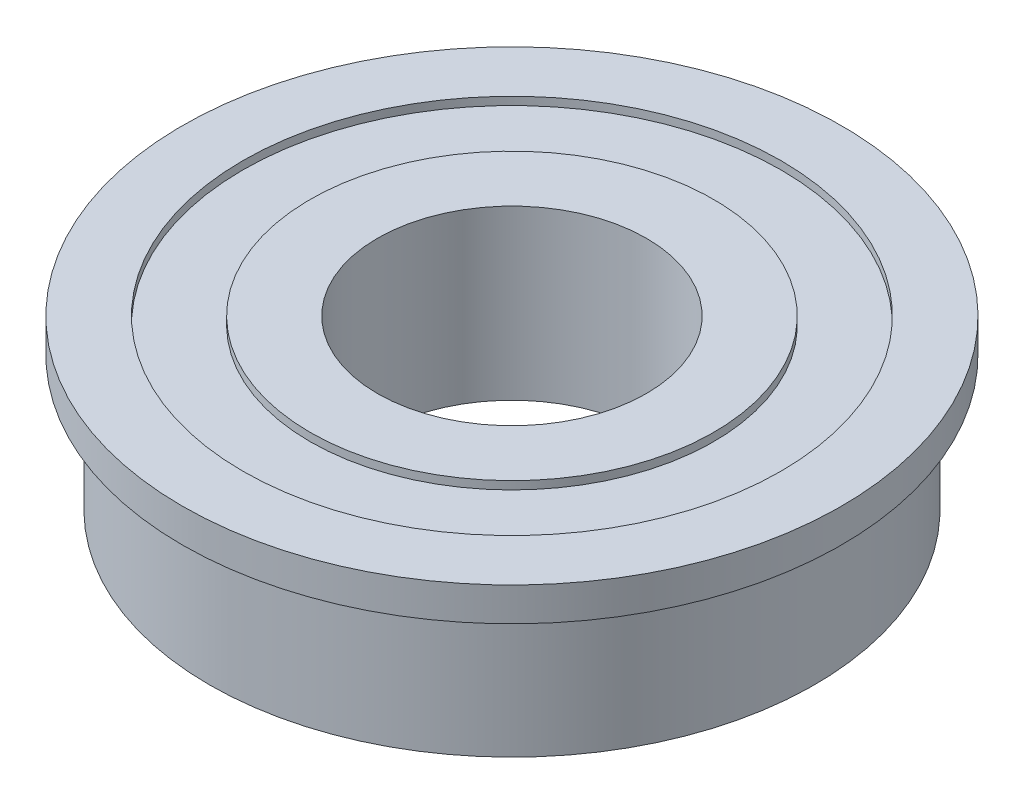
from build123d import *


with BuildPart() as part:
    # Sketch1 → Revolve1 (revolve)
    with BuildSketch(Plane(origin=(0, 0, 0), x_dir=(-1, 0, 0), z_dir=(0, 0, -1)), mode=Mode.PRIVATE) as revolve1_sk:
        Polygon((-9.525, 7.5565), (-12.7, 7.5565), (-12.7, 7.9375), (-15.5575, 7.9375), (-15.5575, 6.35), (-14.2875, 6.35), (-14.2875, 0), (-6.35, 0), (-6.35, 7.9375), (-9.525, 7.9375), align=None)
    revolve(revolve1_sk.sketch.rotate(Axis((0, 0, 0), (0, 1, 0)), 270), axis=Axis((0, 0, 0), (0, 1, 0)))


solid = part.part
